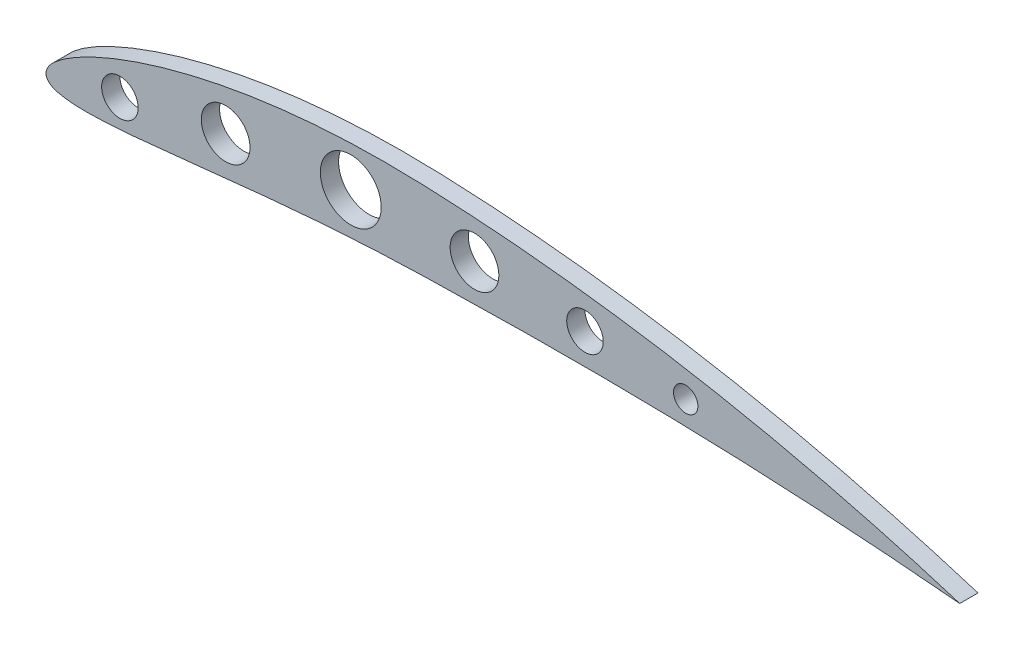
from build123d import *

# Parameters (mm, degrees)
SKETCH_1_R      = 5
SKETCH_1_R_2    = 2
SKETCH_1_R_3    = 4
SKETCH_1_R_4    = 3
EXTRUDE_1_DEPTH = 3


with BuildPart() as part:
    # 草圖1 → 填料-伸長1 (new body)
    with BuildSketch(Plane.XY):
        with BuildLine():
            add(Edge.make_bspline(
                [(150, 0), (150.003329288, 0.014662249), (149.134973151, 0.248896497), (148.258218065, 0.556736362), (146.092264589, 1.19654633), (143.419462384, 1.997789127), (139.897382495, 3.005038527), (135.708200057, 4.154041292), (130.840351885, 5.420232368), (125.358407531, 6.753913203), (119.31702646, 8.120739183), (112.776533722, 9.473156419), (105.808189141, 10.773553055), (98.485274235, 11.982118324), (90.886728987, 13.063455655), (83.096316411, 13.987889127), (75.200877563, 14.729656465), (67.286704542, 15.25830266), (59.402091752, 15.594935226), (51.630745923, 15.598510491), (44.077210829, 15.199915691), (36.878840277, 14.454188136), (30.128312478, 13.397301628), (23.910802822, 12.083683814), (18.300262495, 10.581250725), (13.36381627, 8.955254866), (9.152031644, 7.285662965), (5.711797111, 5.627971866), (3.05382609, 4.06651589), (1.211649191, 2.613296927), (0.085052112, 1.33763686), (-0.180458674, -0.052522495), (0.796524923, -1.070468274), (2.412957253, -1.531391633), (4.695128282, -1.800710881), (7.688152079, -1.813326828), (11.362065222, -1.628688519), (15.679991378, -1.260199332), (20.592376907, -0.755998833), (26.049205768, -0.159719017), (31.992378272, 0.483630715), (38.36817055, 1.120822654), (45.115172975, 1.696162048), (52.175397469, 2.171321279), (59.525268515, 2.486110356), (67.096034109, 2.662547851), (74.806947018, 2.819552249), (82.537296353, 2.899289141), (90.200171891, 2.907391475), (97.713103929, 2.834400016), (104.993995583, 2.685716838), (111.962787733, 2.467215791), (118.541868922, 2.194166582), (124.656667343, 1.879705976), (130.234494892, 1.545592693), (135.216199769, 1.206532161), (139.523505248, 0.887469493), (143.160651508, 0.59419017), (145.933395979, 0.365370935), (148.178013554, 0.152677436), (149.106467307, 0.101669235), (149.996691267, -0.014571725), (150, 0)],
                knots=[0, 0, 0, 0, 0.001374553, 0.005484497, 0.012273361, 0.021682196, 0.033580612, 0.047830743, 0.064305953, 0.082777332, 0.103063756, 0.124929017, 0.148149111, 0.172444695, 0.197572106, 0.223268881, 0.249227775, 0.275186209, 0.300900709, 0.326462938, 0.351222485, 0.374905859, 0.397269706, 0.418072414, 0.437079533, 0.454093094, 0.468919632, 0.481391712, 0.491447127, 0.499023571, 0.504293734, 0.507921918, 0.511539686, 0.516780528, 0.52421649, 0.533991629, 0.546033957, 0.560220284, 0.576403357, 0.594370816, 0.613951104, 0.634916885, 0.657088503, 0.68022991, 0.704175481, 0.729090367, 0.754353776, 0.779667752, 0.80476012, 0.829359339, 0.85320871, 0.876041363, 0.897604065, 0.917662212, 0.93596986, 0.952309788, 0.966502759, 0.978350083, 0.987731492, 0.99451092, 0.998633933, 1, 1, 1, 1], degree=3))
        make_face()
        with Locations((50, 8.834838748)):
            Circle(SKETCH_1_R, mode=Mode.SUBTRACT)
        with Locations((105, 6.556628193)):
            Circle(SKETCH_1_R_2, mode=Mode.SUBTRACT)
        with Locations((29.455100559, 6.556628193)):
            Circle(SKETCH_1_R_3, mode=Mode.SUBTRACT)
        with Locations((70.316815936, 8.834838748)):
            Circle(SKETCH_1_R_3, mode=Mode.SUBTRACT)
        with Locations((88.459585466, 7.953284402)):
            Circle(SKETCH_1_R_4, mode=Mode.SUBTRACT)
        with Locations((12.087934863, 3.040493284)):
            Circle(SKETCH_1_R_4, mode=Mode.SUBTRACT)
    extrude(amount=EXTRUDE_1_DEPTH)


solid = part.part
